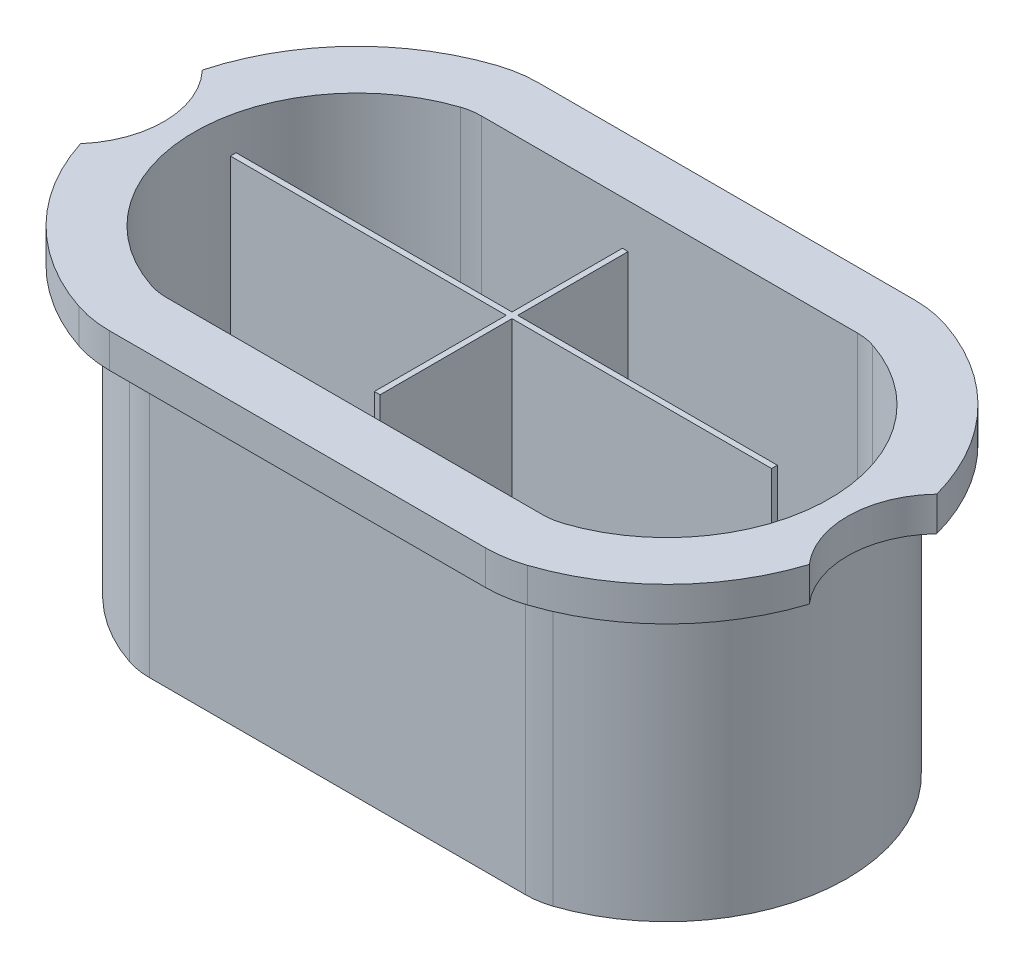
from build123d import *

# Parameters (mm, degrees)
BOSS_EXTRUDE1_DEPTH = 6
FILLET1_R           = 20
SKETCH4_W           = 3
SKETCH4_H           = 50
SKETCH6_R           = 16.245672788
CUT_EXTRUDE1_DEPTH  = 10
BOSS_EXTRUDE2_DEPTH = 3
CUT_EXTRUDE2_DEPTH  = 44
BOSS_EXTRUDE3_DEPTH = 53


with BuildPart() as part:
    # Sketch1 → Boss-Extrude1 (new body)
    with BuildSketch(Plane(origin=(0, 0, 0), x_dir=(1, 0, 0), z_dir=(0, 1, 0))):
        with BuildLine():
            Line((34.540516942, 38.609131748), (-36.459483058, 38.609131748))
            ThreePointArc((-36.459483058, 38.609131748), (-66.459483058, 1.109131748), (-36.459483058, -36.390868252))
            Line((-36.459483058, -36.390868252), (34.540516942, -36.390868252))
            ThreePointArc((34.540516942, -36.390868252), (64.540516942, 1.109131748), (34.540516942, 38.609131748))
        make_face()
    extrude(amount=BOSS_EXTRUDE1_DEPTH)

    # Fillet1
    fillet1_edges = [part.edges().sort_by_distance(p)[0] for p in [
        (-36.459483058, 3, -38.609131748),
        (34.540516942, 3, -38.609131748),
        (34.540516942, 3, 36.390868252),
        (-36.459483058, 3, 36.390868252),
    ]]
    fillet(fillet1_edges, radius=FILLET1_R)

    # Sweep1: sweep along a path in Sketch3
    with BuildLine(Plane.XZ) as sweep1_path:
        Line((31.907446823, 29.390868252), (-33.82641294, 29.390868252))
        ThreePointArc((-33.82641294, 29.390868252), (-35.899239553, 29.224550102), (-37.919027907, 28.729851303))
        ThreePointArc((-37.919027907, 28.729851303), (-59.459483058, -1.109131748), (-37.919027907, -30.948114799))
        ThreePointArc((-37.919027907, -30.948114799), (-35.899239553, -31.442813598), (-33.82641294, -31.609131748))
        Line((-33.82641294, -31.609131748), (31.907446823, -31.609131748))
        ThreePointArc((31.907446823, -31.609131748), (33.980273437, -31.442813598), (36.000061791, -30.948114799))
        ThreePointArc((36.000061791, -30.948114799), (57.540516942, -1.109131748), (36.000061791, 28.729851303))
        ThreePointArc((36.000061791, 28.729851303), (33.980273437, 29.224550102), (31.907446823, 29.390868252))
    # Sketch4 → Sweep1 (sweep)
    with BuildSketch(Plane(origin=(31.907446823, 0, -31.609131748), x_dir=(0, 0, -1), z_dir=(1, 0, 0))):
        with Locations((-1.5, -25)):
            Rectangle(SKETCH4_W, SKETCH4_H)
    sweep(path=sweep1_path.line)

    # Sketch6 → Cut-Extrude1 (cut)
    with BuildSketch(Plane(origin=(0, 0, 0), x_dir=(1, 0, 0), z_dir=(0, 1, 0))):
        with Locations((75, 0)):
            Circle(SKETCH6_R)
        with Locations((-76.918966117, 0)):
            Circle(SKETCH6_R)
    extrude(amount=CUT_EXTRUDE1_DEPTH, mode=Mode.SUBTRACT)

    # Sketch7 → Boss-Extrude2 (add)
    with BuildSketch(Plane.XZ.offset(50)):
        with BuildLine():
            Line((31.907446823, 26.390868252), (-33.82641294, 26.390868252))
            ThreePointArc((-33.82641294, 26.390868252), (-35.42089495, 26.262931214), (-36.974578299, 25.882393676))
            ThreePointArc((-36.974578299, 25.882393676), (-56.459483058, -1.109131748), (-36.974578299, -28.100657171))
            ThreePointArc((-36.974578299, -28.100657171), (-35.42089495, -28.481194709), (-33.82641294, -28.609131748))
            Line((-33.82641294, -28.609131748), (31.907446823, -28.609131748))
            ThreePointArc((31.907446823, -28.609131748), (33.501928834, -28.481194709), (35.055612183, -28.100657171))
            ThreePointArc((35.055612183, -28.100657171), (54.540516942, -1.109131748), (35.055612183, 25.882393676))
            ThreePointArc((35.055612183, 25.882393676), (33.501928834, 26.262931214), (31.907446823, 26.390868252))
        make_face()
    extrude(amount=-BOSS_EXTRUDE2_DEPTH)

    # Sketch9 → Cut-Extrude2 (cut)
    with BuildSketch(Plane.XZ):
        with BuildLine():
            Line((-33.82641294, -28.609131748), (31.907446823, -28.609131748))
            ThreePointArc((31.907446823, -28.609131748), (33.501928834, -28.481194709), (35.055612183, -28.100657171))
            ThreePointArc((35.055612183, -28.100657171), (54.540516942, -1.109131748), (35.055612183, 25.882393676))
            ThreePointArc((35.055612183, 25.882393676), (33.501928834, 26.262931214), (31.907446823, 26.390868252))
            Line((31.907446823, 26.390868252), (-33.82641294, 26.390868252))
            ThreePointArc((-33.82641294, 26.390868252), (-35.42089495, 26.262931214), (-36.974578299, 25.882393676))
            ThreePointArc((-36.974578299, 25.882393676), (-56.459483058, -1.109131748), (-36.974578299, -28.100657171))
            ThreePointArc((-36.974578299, -28.100657171), (-35.42089495, -28.481194709), (-33.82641294, -28.609131748))
        make_face()
    extrude(amount=-CUT_EXTRUDE2_DEPTH, mode=Mode.SUBTRACT)

    # Sketch10 → Boss-Extrude3 (add)
    with BuildSketch(Plane(origin=(0, -47, 0), x_dir=(1, 0, 0), z_dir=(0, 1, 0))):
        Polygon((-0.459483058, 1.609131748), (44.905858694, 1.609131748), (44.905858694, 0.609131748), (-0.459483058, 0.609131748), (-0.459483058, -22.435523008), (-1.459483058, -22.435523008), (-1.459483058, 0.609131748), (-49.663240978, 0.609131748), (-49.663240978, 1.609131748), (-1.459483058, 1.609131748), (-1.459483058, 20.900521065), (-0.459483058, 20.900521065), align=None)
    extrude(amount=BOSS_EXTRUDE3_DEPTH)


solid = part.part
